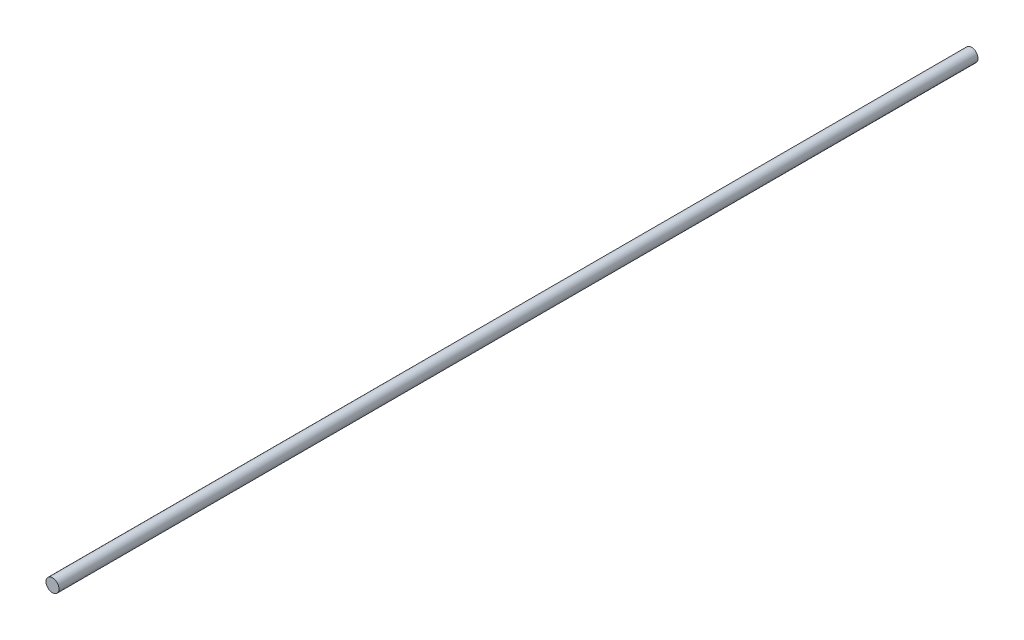
from build123d import *

# Parameters (mm, degrees)
SKETCH1_R           = 12.5
BOSS_EXTRUDE1_DEPTH = 1770


with BuildPart() as part:
    # Sketch1 → Boss-Extrude1 (new body)
    with BuildSketch(Plane.XY):
        Circle(SKETCH1_R)
    extrude(amount=BOSS_EXTRUDE1_DEPTH)


solid = part.part
